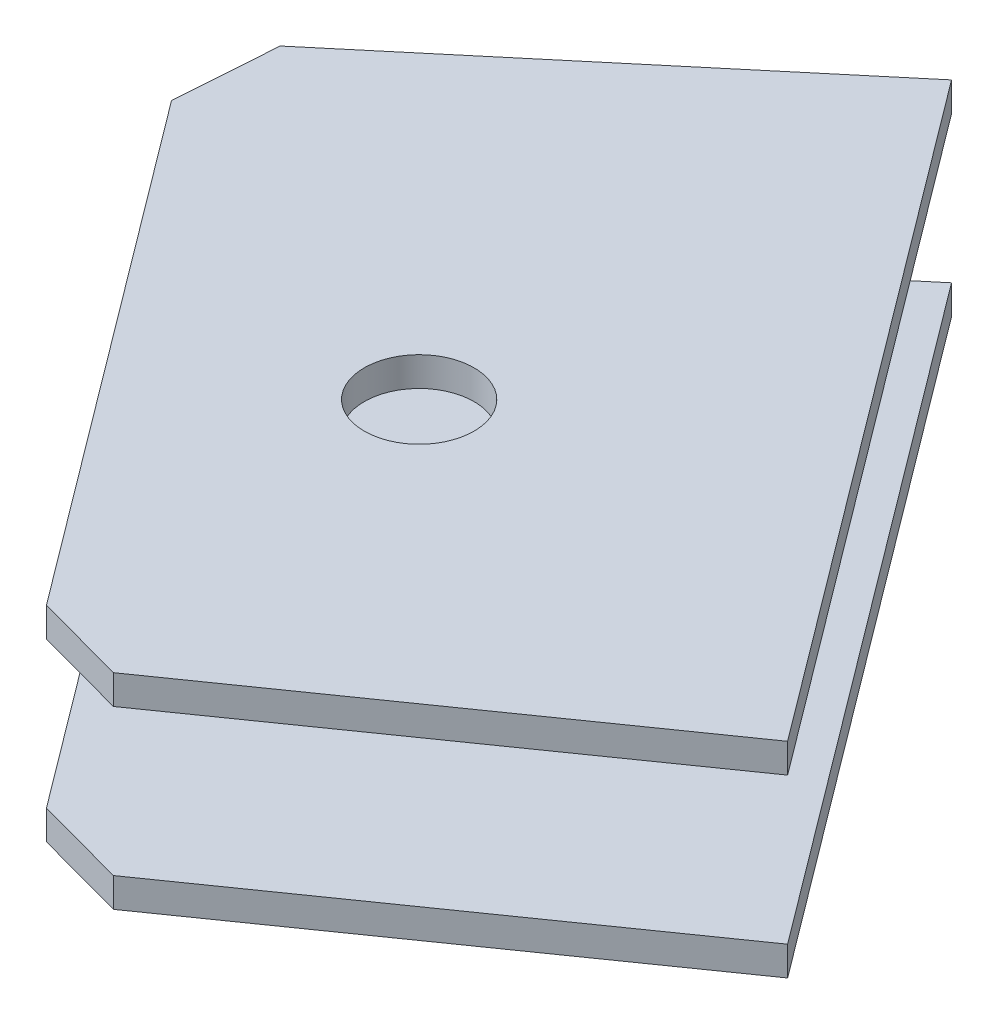
from build123d import *

# Parameters (mm, degrees)
SKETCH2_R           = 4.7625
BOSS_EXTRUDE1_DEPTH = 2.54
SKETCH3_R           = 4.7625
BOSS_EXTRUDE2_DEPTH = 2.54


with BuildPart() as part:
    # Sketch2 → Boss-Extrude1 (new body)
    with BuildSketch(Plane(origin=(0, 6.35, 0), x_dir=(-1, 0, 0), z_dir=(0, 1, 0))):
        Polygon((-41.655528976, 9.698028228), (0.915104633, -47.091558912), (32.577290188, -20.52382815), (33.194911519, -11.716245654), (0.713995358, 31.613572635), (-7.258770993, 33.782899871), align=None)
        with Locations(Location((0, 0, 0), (0, 0, 90))):
            Circle(SKETCH2_R, mode=Mode.SUBTRACT)
    extrude(amount=BOSS_EXTRUDE1_DEPTH)


with BuildPart() as body_2:
    # Sketch3 → Boss-Extrude2 (new body)
    with BuildSketch(Plane(origin=(0, -6.35, 0), x_dir=(-1, 0, 0), z_dir=(0, 1, 0))):
        Polygon((-7.258770993, 33.782899871), (-41.655528976, 9.698028228), (0.915104633, -47.091558912), (32.577290188, -20.52382815), (33.194911519, -11.716245654), (0.713995358, 31.613572635), align=None)
        with Locations(Location((0, 0, 0), (0, 0, 90))):
            Circle(SKETCH3_R, mode=Mode.SUBTRACT)
    extrude(amount=-BOSS_EXTRUDE2_DEPTH)


solid = Compound([part.part, body_2.part])
